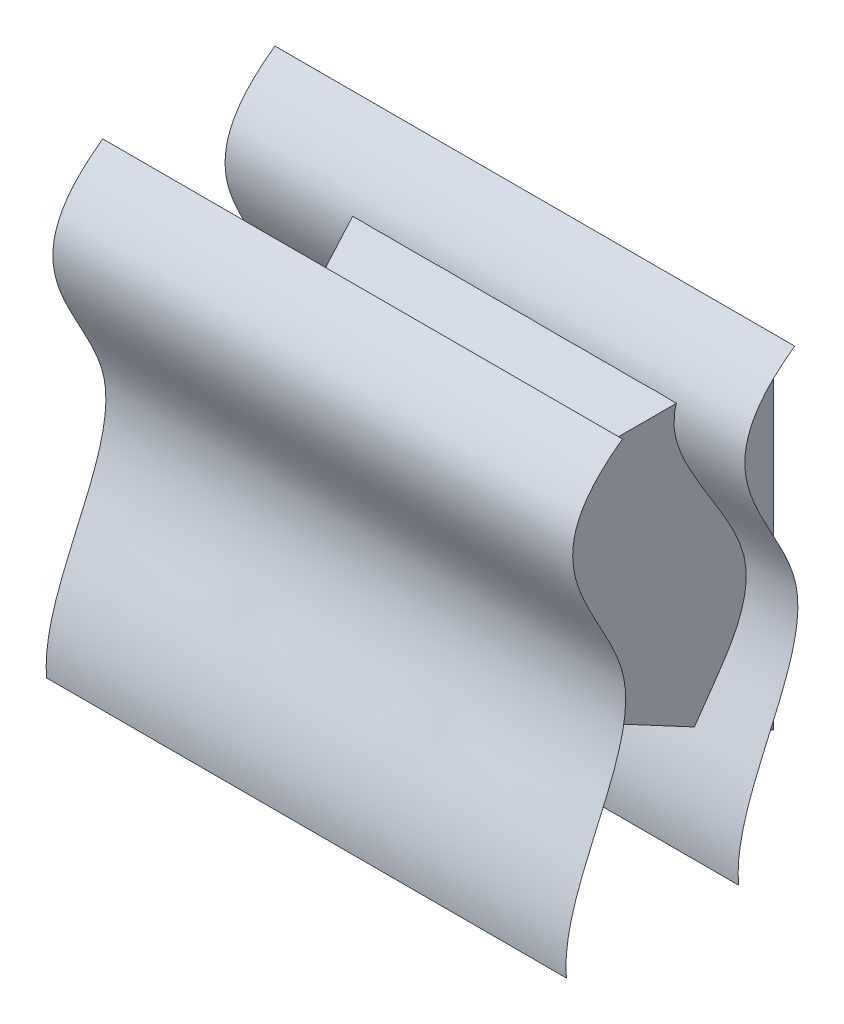
from build123d import *

# Parameters (mm, degrees)
F_1_FR_W        = 43.350723316
F_1_FR_H        = 38.259713105
EXTRUDE_1_DEPTH = 20
EXTRUDE_1_TAPER = 20


with BuildPart() as part:
    # Эскиз1_fr → Бобышка-Вытянуть1 (new body)
    with BuildSketch(Plane.XY):
        with Locations((21.675361658, -19.129856553)):
            Rectangle(F_1_FR_W, F_1_FR_H)
    extrude(amount=EXTRUDE_1_DEPTH, taper=EXTRUDE_1_TAPER)


solid = part.part
